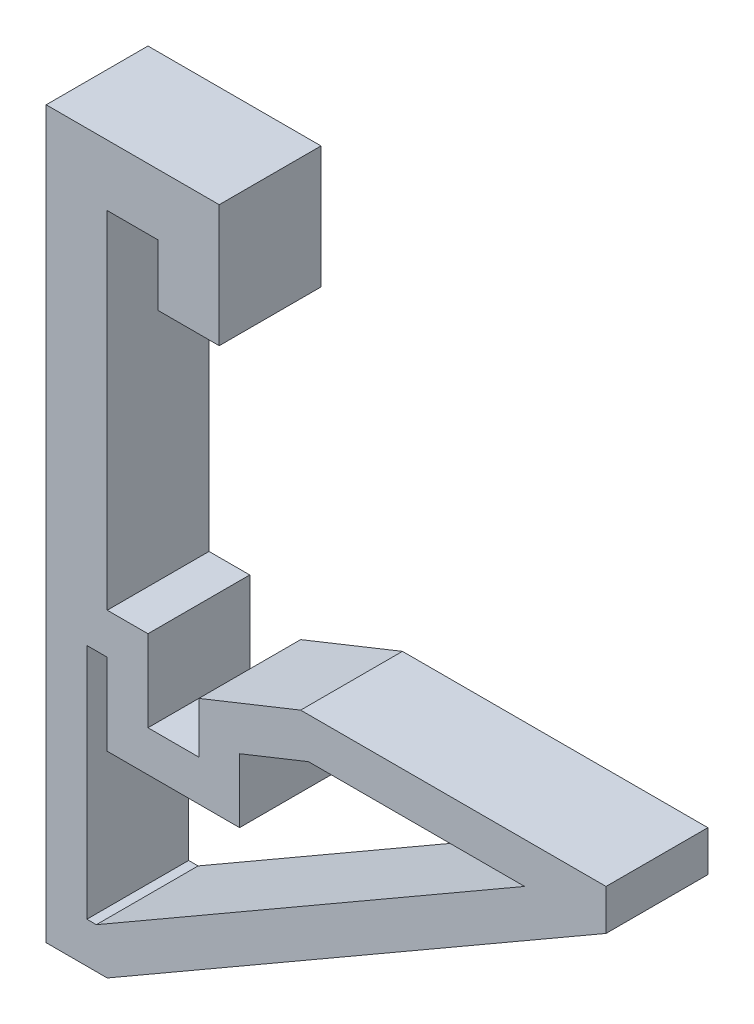
from build123d import *

# Parameters (mm, degrees)
EXTRUDE_1_DEPTH     = 5
CUT_EXTRUDE_1_DEPTH = 46.297040101


with BuildPart() as part:
    # 草图1 → 凸台-拉伸1 (new body)
    with BuildSketch(Plane.XY):
        Polygon((0, 0), (0, 35.645081595), (8.5, 35.645081595), (8.5, 29.645081595), (5.5, 29.645081595), (5.5, 32.645081595), (3, 32.645081595), (3, 15.645081595), (5, 15.645081595), (5, 11.645081595), (7.5, 11.645081595), (7.5, 14.145081595), (12.5, 16.145081595), (27.5, 16.145081595), (27.5, 14.145081595), (3, 0), align=None)
    extrude(amount=EXTRUDE_1_DEPTH)

    # 草图2 → 切除-拉伸1 (cut, through all)
    with BuildSketch(Plane.XY.offset(5)):
        Polygon((9.5, 12.791015672), (9.5, 9.645081595), (3, 9.645081595), (3, 13.645081595), (2, 13.645081595), (2, 2), (2.464101615, 2), (23.5, 14.145081595), (12.885164807, 14.145081595), align=None)
    extrude(amount=-CUT_EXTRUDE_1_DEPTH, mode=Mode.SUBTRACT)


solid = part.part
